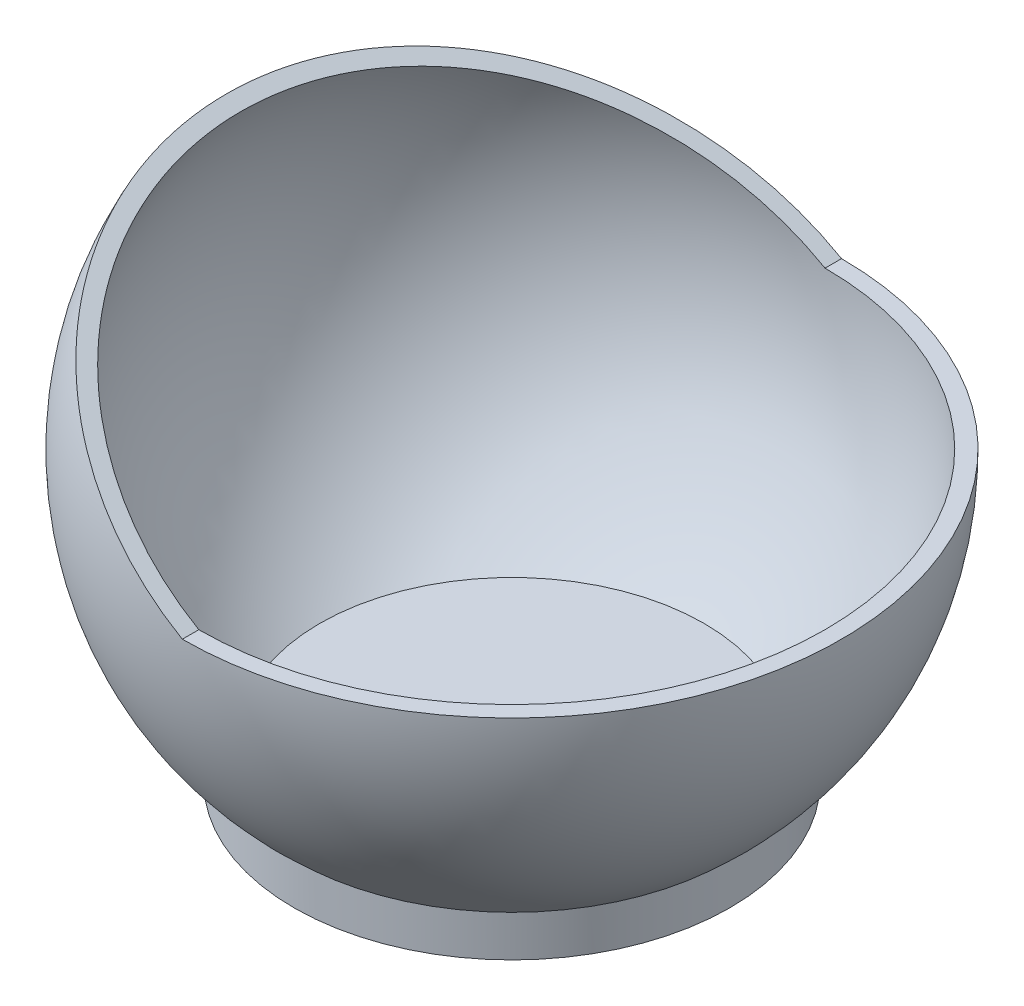
from build123d import *

# Parameters (mm, degrees)
KES_EKSTR_ZYON1_DEPTH            = 70.282032303
KES_EKSTR_ZYON1_DEPTH_BACK       = 70.282032303
IZIM2_W                          = 52.915026222
IZIM2_H                          = 20
IZIM4_R                          = 26.457513111
Y_KSEKLIK_EKSTR_ZYON1_DEPTH      = 5
Y_KSEKLIK_EKSTR_ZYON5_DEPTH      = 5
Y_KSEKLIK_EKSTR_ZYON5_DEPTH_BACK = 5


with BuildPart() as part:
    # Çizim1 → Döndür1 (revolve)
    with BuildSketch(Plane.XY):
        with BuildLine():
            Line((0, 38), (0, 40))
            ThreePointArc((0, 40), (40, 0), (0, -40))
            Line((0, -40), (0, -38))
            ThreePointArc((0, -38), (38, 0), (0, 38))
        make_face()
    revolve(axis=Axis((0, 48.642187878, 0), (0, -1, 0)))

    # Çizim2 → Kes-Ekstrüzyon1 (cut, two sides: drawn at the far end of the back side and taken through both)
    with BuildSketch(Plane.XY.offset(-KES_EKSTR_ZYON1_DEPTH_BACK)):
        with BuildLine():
            Line((0, 0), (40, 0))
            ThreePointArc((40, 0), (10.352761804, 38.637033052), (-34.641016151, 20))
            Line((-34.641016151, 20), (0, 0))
        make_face()
        with Locations((0, -40)):
            Rectangle(IZIM2_W, IZIM2_H)
    extrude(amount=KES_EKSTR_ZYON1_DEPTH + KES_EKSTR_ZYON1_DEPTH_BACK, mode=Mode.SUBTRACT)

    # Çizim4 → Yükseklik-Ekstrüzyon1 (add)
    with BuildSketch(Plane.XZ.offset(30)):
        Circle(IZIM4_R)
    extrude(amount=Y_KSEKLIK_EKSTR_ZYON1_DEPTH)

    # Çizim13 → Yükseklik-Ekstrüzyon5 (add, two sides: drawn at the far end of the back side and taken through both)
    with BuildSketch(Plane.XY.offset(-Y_KSEKLIK_EKSTR_ZYON5_DEPTH_BACK)):
        with BuildLine():
            Line((-17.204650534, -35), (-31.457513111, -35))
            Line((-31.457513111, -35), (-31.457513111, -23.05265427))
            ThreePointArc((-31.457513111, -23.05265427), (-25.053668597, -29.88835375), (-17.204650534, -35))
        make_face()
    extrude(amount=Y_KSEKLIK_EKSTR_ZYON5_DEPTH + Y_KSEKLIK_EKSTR_ZYON5_DEPTH_BACK)


solid = part.part
